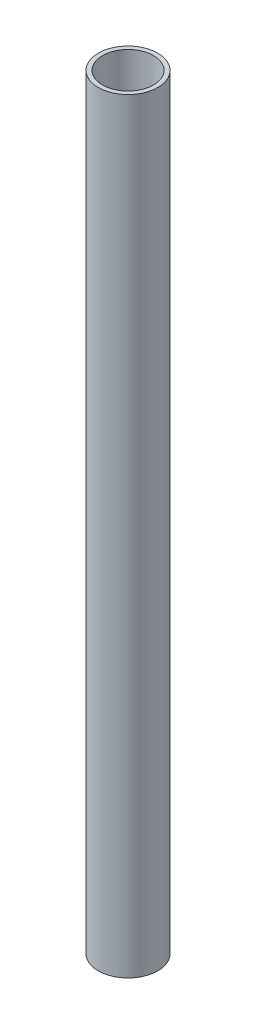
from build123d import *

# Parameters (mm, degrees)
SKETCH1_R           = 10.5
SKETCH1_R_2         = 9
EXTRUDE_THIN1_DEPTH = 270


with BuildPart() as part:
    # Sketch1 → Extrude-Thin1 (new body)
    with BuildSketch(Plane(origin=(0, 0, 0), x_dir=(1, 0, 0), z_dir=(0, 1, 0))):
        Circle(SKETCH1_R)
        Circle(SKETCH1_R_2, mode=Mode.SUBTRACT)
    extrude(amount=EXTRUDE_THIN1_DEPTH)


solid = part.part
